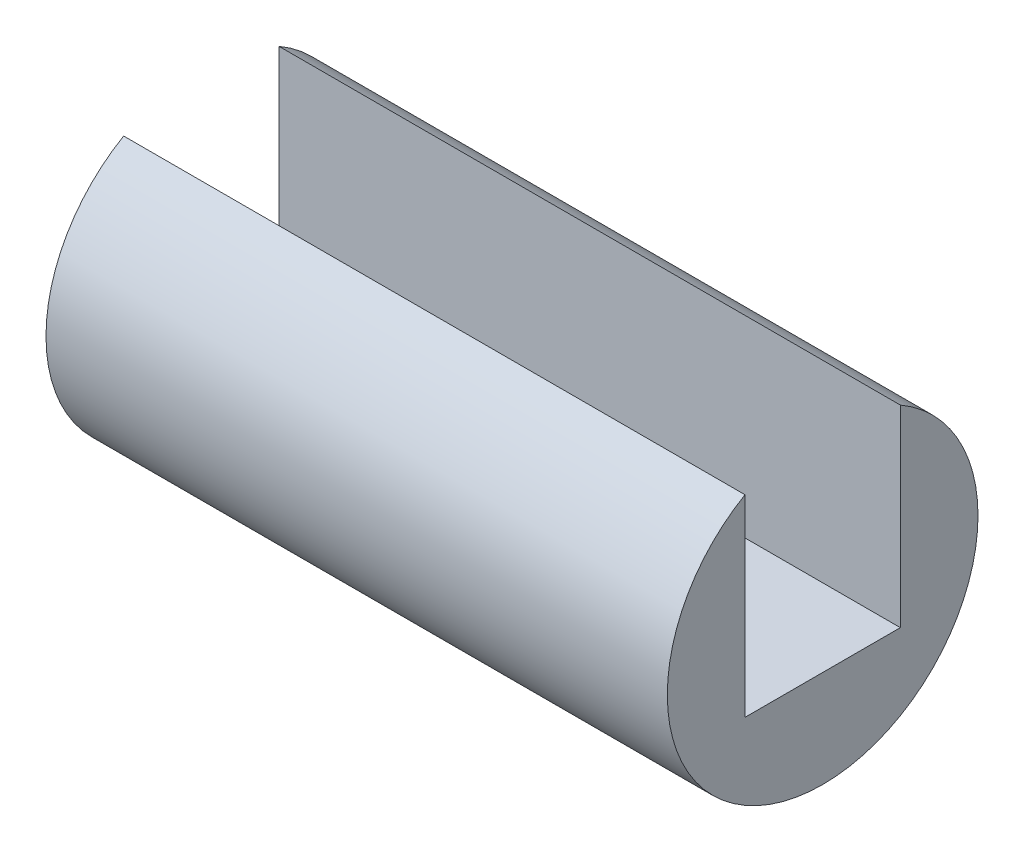
from build123d import *

# Parameters (mm, degrees)
BOSS_EXTRUDE1_DEPTH = 25.4


with BuildPart() as part:
    # Sketch1 → Boss-Extrude1 (new body)
    with BuildSketch(Plane(origin=(0, 0, 0), x_dir=(0, 0, -1), z_dir=(1, 0, 0))):
        with BuildLine():
            Line((3.175, 2.38125), (-3.175, 2.38125))
            Line((-3.175, 2.38125), (-3.175, 10.261761314))
            ThreePointArc((-3.175, 10.261761314), (0, -1.5875), (3.175, 10.261761314))
            Line((3.175, 10.261761314), (3.175, 2.38125))
        make_face()
    extrude(amount=BOSS_EXTRUDE1_DEPTH)


solid = part.part
